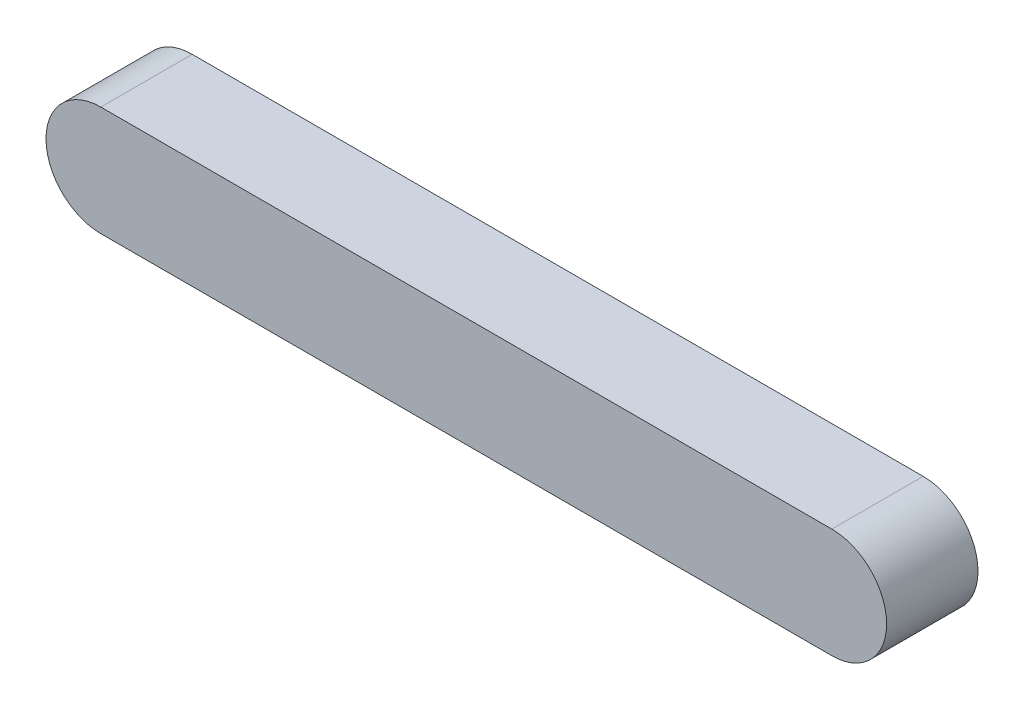
from build123d import *

# Parameters (mm, degrees)
BOSS_EXTRUDE1_DEPTH = 5


with BuildPart() as part:
    # Sketch1 → Boss-Extrude1 (new body)
    with BuildSketch(Plane.XY):
        with BuildLine():
            Line((0, 3), (40, 3))
            ThreePointArc((40, 3), (43, 0), (40, -3))
            Line((40, -3), (0, -3))
            ThreePointArc((0, -3), (-3, 0), (0, 3))
        make_face()
    extrude(amount=BOSS_EXTRUDE1_DEPTH)


solid = part.part
